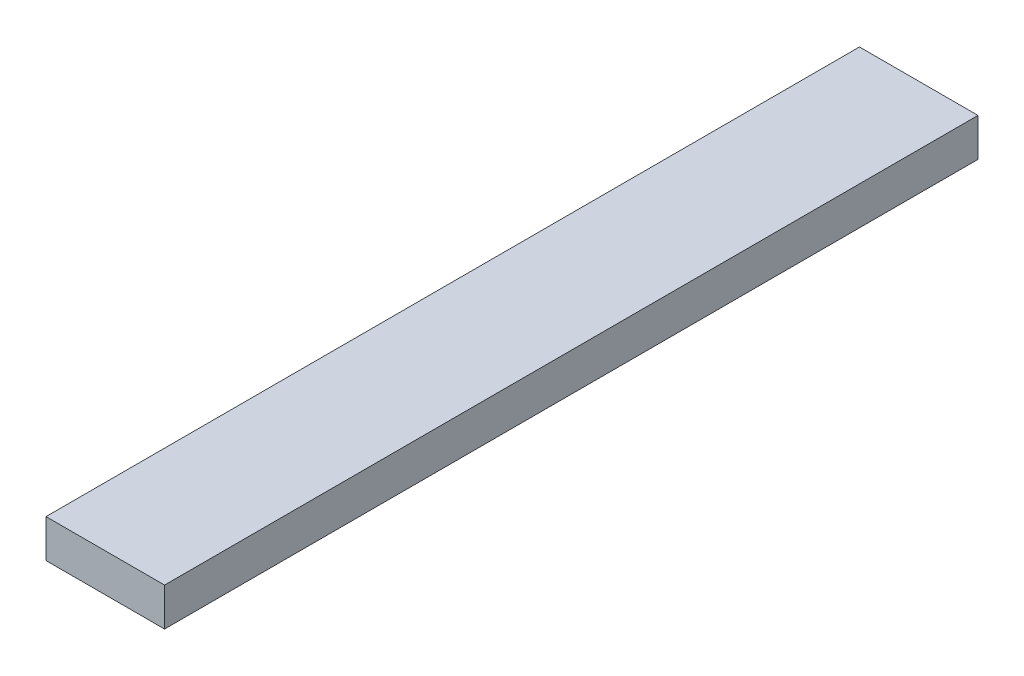
from build123d import *

# Parameters (mm, degrees)
SKETCH1_W           = 88.9
SKETCH1_H           = 28.575
BOSS_EXTRUDE1_DEPTH = 610


with BuildPart() as part:
    # Sketch1 → Boss-Extrude1 (new body)
    with BuildSketch(Plane.XY):
        with Locations((44.45, 14.2875)):
            Rectangle(SKETCH1_W, SKETCH1_H)
    extrude(amount=BOSS_EXTRUDE1_DEPTH)


solid = part.part
